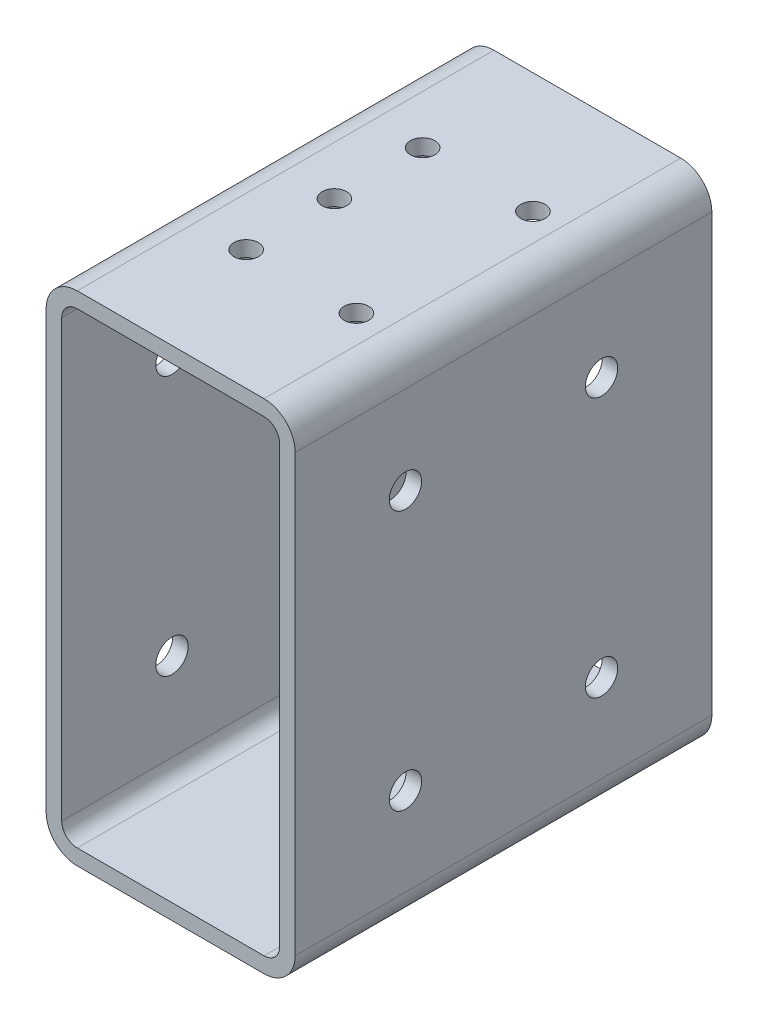
from build123d import *

# Parameters (mm, degrees)
CNC_4X2X0_125_1_DEPTH = 85
SKETCH3_R             = 2.5
CUT_EXTRUDE1_DEPTH    = 10
SKETCH2_R             = 3.3
CUT_EXTRUDE2_DEPTH    = 84.471731742


with BuildPart() as part:
    # Sketch1 → Cnc 4X2X0.125(1) (new body)
    with BuildSketch(Plane.YX.offset(-42.5)):
        with BuildLine():
            Line((44.45, -25.4), (-44.45, -25.4))
            ThreePointArc((-44.45, -25.4), (-48.940128061, -23.540128061), (-50.8, -19.05))
            Line((-50.8, -19.05), (-50.8, 19.05))
            ThreePointArc((-50.8, 19.05), (-48.940128061, 23.540128061), (-44.45, 25.4))
            Line((-44.45, 25.4), (44.45, 25.4))
            ThreePointArc((44.45, 25.4), (48.940128061, 23.540128061), (50.8, 19.05))
            Line((50.8, 19.05), (50.8, -19.05))
            ThreePointArc((50.8, -19.05), (48.940128061, -23.540128061), (44.45, -25.4))
        make_face()
        with BuildLine():
            Line((44.45, 22.225), (-44.45, 22.225))
            ThreePointArc((-44.45, 22.225), (-46.69506403, 21.29506403), (-47.625, 19.05))
            Line((-47.625, 19.05), (-47.625, -19.05))
            ThreePointArc((-47.625, -19.05), (-46.69506403, -21.29506403), (-44.45, -22.225))
            Line((-44.45, -22.225), (44.45, -22.225))
            ThreePointArc((44.45, -22.225), (46.69506403, -21.29506403), (47.625, -19.05))
            Line((47.625, -19.05), (47.625, 19.05))
            ThreePointArc((47.625, 19.05), (46.69506403, 21.29506403), (44.45, 22.225))
        make_face(mode=Mode.SUBTRACT)
    extrude(amount=CNC_4X2X0_125_1_DEPTH)

    # Sketch3 → Cut-Extrude1 (cut)
    with BuildSketch(Plane(origin=(0, 50.8, 0), x_dir=(1, 0, 0), z_dir=(0, 1, 0))):
        with Locations(Location((-9.1, 18, 0), (0, 0, 180))):
            Circle(SKETCH3_R)
        with Locations(Location((-9.1, 0, 0), (0, 0, 180))):
            Circle(SKETCH3_R)
        with Locations(Location((-9.1, -18, 0), (0, 0, 180))):
            Circle(SKETCH3_R)
        with Locations(Location((13.4, 18, 0), (0, 0, 180))):
            Circle(SKETCH3_R)
        with Locations(Location((13.4, -18, 0), (0, 0, 180))):
            Circle(SKETCH3_R)
    extrude(amount=-CUT_EXTRUDE1_DEPTH, mode=Mode.SUBTRACT)

    # Sketch2 → Cut-Extrude2 (cut, through all)
    with BuildSketch(Plane(origin=(25.4, 0, 0), x_dir=(0, 0, -1), z_dir=(1, 0, 0))):
        with Locations(Location((-20, 26.5, 0), (0, 0, 90))):
            Circle(SKETCH2_R)
        with Locations(Location((20, 26.5, 0), (0, 0, 90))):
            Circle(SKETCH2_R)
        with Locations(Location((20, -26.5, 0), (0, 0, 90))):
            Circle(SKETCH2_R)
        with Locations(Location((-20, -26.5, 0), (0, 0, 90))):
            Circle(SKETCH2_R)
    extrude(amount=-CUT_EXTRUDE2_DEPTH, mode=Mode.SUBTRACT)


solid = part.part
